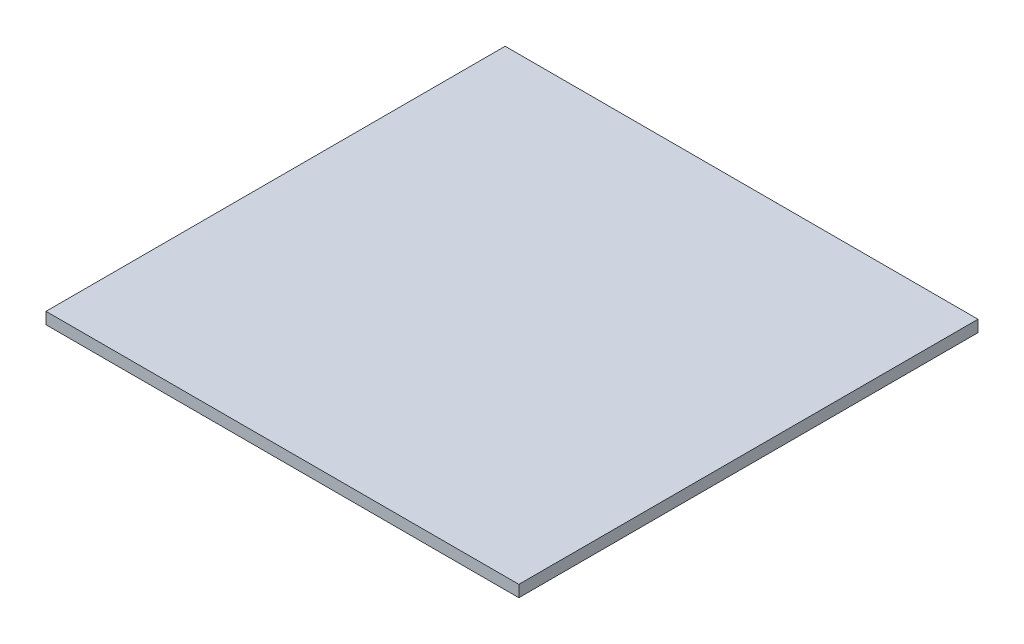
from build123d import *

# Parameters (mm, degrees)
CROQUIS2_W              = 69
CROQUIS2_H              = 67
SALIENTE_EXTRUIR1_DEPTH = 1.7


with BuildPart() as part:
    # Croquis2 → Saliente-Extruir1 (new body)
    with BuildSketch(Plane(origin=(0, 0, 0), x_dir=(1, 0, 0), z_dir=(0, 1, 0))):
        with Locations((34.5, 33.5)):
            Rectangle(CROQUIS2_W, CROQUIS2_H)
    extrude(amount=SALIENTE_EXTRUIR1_DEPTH)


solid = part.part
